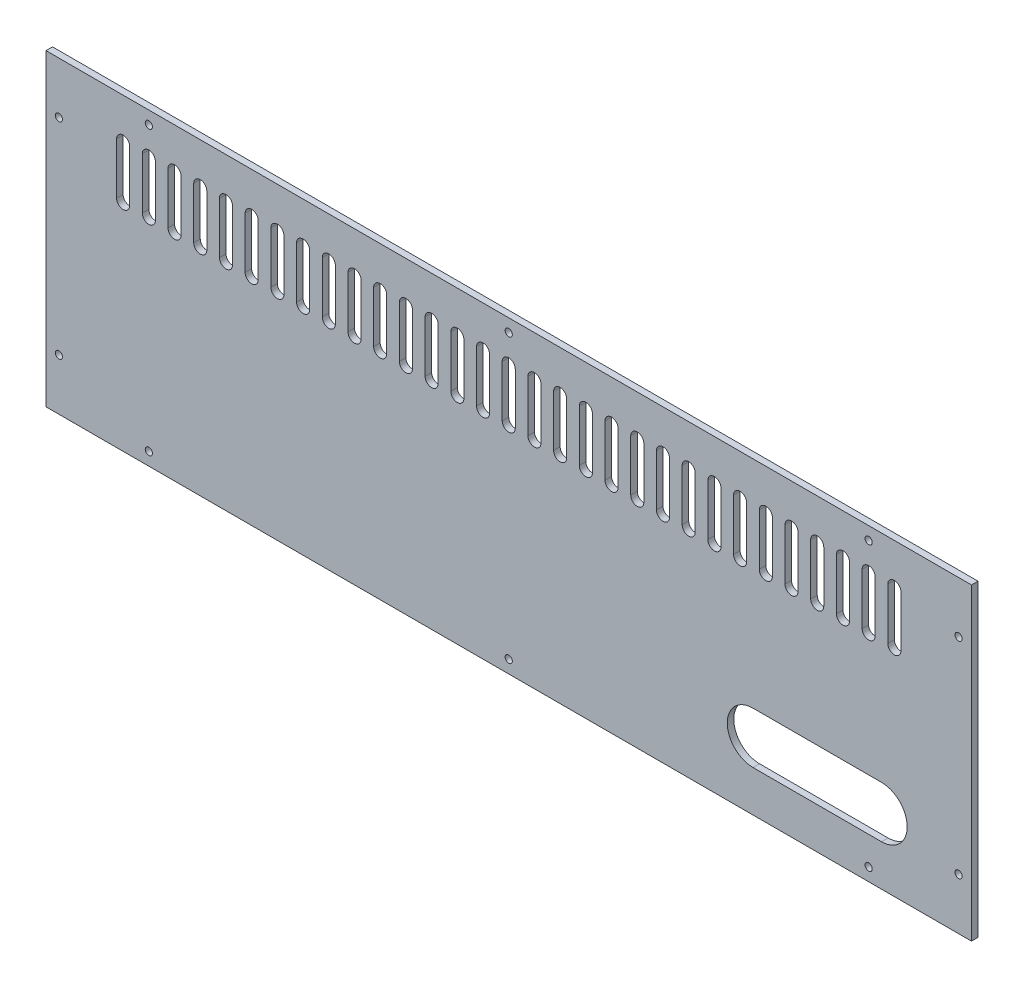
from build123d import *

# Parameters (mm, degrees)
SKETCH2_W           = 900
SKETCH2_H           = 300
BOSS_EXTRUDE1_DEPTH = 6.35
CUT_EXTRUDE1_DEPTH  = 6.35
SKETCH4_R           = 3.5
CUT_EXTRUDE2_DEPTH  = 949.704549636
CUT_EXTRUDE3_DEPTH  = 10


with BuildPart() as part:
    # Sketch2 → Boss-Extrude1 (new body)
    with BuildSketch(Plane.XY):
        with Locations((450, 150)):
            Rectangle(SKETCH2_W, SKETCH2_H)
    extrude(amount=BOSS_EXTRUDE1_DEPTH)

    # Sketch3 → Cut-Extrude1 (cut)
    with BuildSketch(Plane.XY.offset(6.35)):
        with BuildLine():
            Line((443.65, 210), (443.65, 260))
            ThreePointArc((443.65, 260), (450, 266.35), (456.35, 260))
            Line((456.35, 260), (456.35, 210))
            ThreePointArc((456.35, 210), (450, 203.65), (443.65, 210))
        make_face()
        with BuildLine():
            Line((481.35, 210), (481.35, 260))
            ThreePointArc((481.35, 260), (475, 266.35), (468.65, 260))
            Line((468.65, 260), (468.65, 210))
            ThreePointArc((468.65, 210), (475, 203.65), (481.35, 210))
        make_face()
        with BuildLine():
            Line((506.35, 210), (506.35, 260))
            ThreePointArc((506.35, 260), (500, 266.35), (493.65, 260))
            Line((493.65, 260), (493.65, 210))
            ThreePointArc((493.65, 210), (500, 203.65), (506.35, 210))
        make_face()
        with BuildLine():
            Line((531.35, 210), (531.35, 260))
            ThreePointArc((531.35, 260), (525, 266.35), (518.65, 260))
            Line((518.65, 260), (518.65, 210))
            ThreePointArc((518.65, 210), (525, 203.65), (531.35, 210))
        make_face()
        with BuildLine():
            Line((556.35, 210), (556.35, 260))
            ThreePointArc((556.35, 260), (550, 266.35), (543.65, 260))
            Line((543.65, 260), (543.65, 210))
            ThreePointArc((543.65, 210), (550, 203.65), (556.35, 210))
        make_face()
        with BuildLine():
            Line((581.35, 210), (581.35, 260))
            ThreePointArc((581.35, 260), (575, 266.35), (568.65, 260))
            Line((568.65, 260), (568.65, 210))
            ThreePointArc((568.65, 210), (575, 203.65), (581.35, 210))
        make_face()
        with BuildLine():
            Line((606.35, 210), (606.35, 260))
            ThreePointArc((606.35, 260), (600, 266.35), (593.65, 260))
            Line((593.65, 260), (593.65, 210))
            ThreePointArc((593.65, 210), (600, 203.65), (606.35, 210))
        make_face()
        with BuildLine():
            Line((631.35, 210), (631.35, 260))
            ThreePointArc((631.35, 260), (625, 266.35), (618.65, 260))
            Line((618.65, 260), (618.65, 210))
            ThreePointArc((618.65, 210), (625, 203.65), (631.35, 210))
        make_face()
        with BuildLine():
            Line((656.35, 210), (656.35, 260))
            ThreePointArc((656.35, 260), (650, 266.35), (643.65, 260))
            Line((643.65, 260), (643.65, 210))
            ThreePointArc((643.65, 210), (650, 203.65), (656.35, 210))
        make_face()
        with BuildLine():
            Line((681.35, 210), (681.35, 260))
            ThreePointArc((681.35, 260), (675, 266.35), (668.65, 260))
            Line((668.65, 260), (668.65, 210))
            ThreePointArc((668.65, 210), (675, 203.65), (681.35, 210))
        make_face()
        with BuildLine():
            Line((706.35, 210), (706.35, 260))
            ThreePointArc((706.35, 260), (700, 266.35), (693.65, 260))
            Line((693.65, 260), (693.65, 210))
            ThreePointArc((693.65, 210), (700, 203.65), (706.35, 210))
        make_face()
        with BuildLine():
            Line((731.35, 210), (731.35, 260))
            ThreePointArc((731.35, 260), (725, 266.35), (718.65, 260))
            Line((718.65, 260), (718.65, 210))
            ThreePointArc((718.65, 210), (725, 203.65), (731.35, 210))
        make_face()
        with BuildLine():
            Line((756.35, 210), (756.35, 260))
            ThreePointArc((756.35, 260), (750, 266.35), (743.65, 260))
            Line((743.65, 260), (743.65, 210))
            ThreePointArc((743.65, 210), (750, 203.65), (756.35, 210))
        make_face()
        with BuildLine():
            Line((781.35, 210), (781.35, 260))
            ThreePointArc((781.35, 260), (775, 266.35), (768.65, 260))
            Line((768.65, 260), (768.65, 210))
            ThreePointArc((768.65, 210), (775, 203.65), (781.35, 210))
        make_face()
        with BuildLine():
            Line((806.35, 210), (806.35, 260))
            ThreePointArc((806.35, 260), (800, 266.35), (793.65, 260))
            Line((793.65, 260), (793.65, 210))
            ThreePointArc((793.65, 210), (800, 203.65), (806.35, 210))
        make_face()
        with BuildLine():
            Line((831.35, 210), (831.35, 260))
            ThreePointArc((831.35, 260), (825, 266.35), (818.65, 260))
            Line((818.65, 260), (818.65, 210))
            ThreePointArc((818.65, 210), (825, 203.65), (831.35, 210))
        make_face()
        with BuildLine():
            Line((431.35, 210), (431.35, 260))
            ThreePointArc((431.35, 260), (425, 266.35), (418.65, 260))
            Line((418.65, 260), (418.65, 210))
            ThreePointArc((418.65, 210), (425, 203.65), (431.35, 210))
        make_face()
        with BuildLine():
            Line((406.35, 210), (406.35, 260))
            ThreePointArc((406.35, 260), (400, 266.35), (393.65, 260))
            Line((393.65, 260), (393.65, 210))
            ThreePointArc((393.65, 210), (400, 203.65), (406.35, 210))
        make_face()
        with BuildLine():
            Line((381.35, 210), (381.35, 260))
            ThreePointArc((381.35, 260), (375, 266.35), (368.65, 260))
            Line((368.65, 260), (368.65, 210))
            ThreePointArc((368.65, 210), (375, 203.65), (381.35, 210))
        make_face()
        with BuildLine():
            Line((356.35, 210), (356.35, 260))
            ThreePointArc((356.35, 260), (350, 266.35), (343.65, 260))
            Line((343.65, 260), (343.65, 210))
            ThreePointArc((343.65, 210), (350, 203.65), (356.35, 210))
        make_face()
        with BuildLine():
            Line((331.35, 210), (331.35, 260))
            ThreePointArc((331.35, 260), (325, 266.35), (318.65, 260))
            Line((318.65, 260), (318.65, 210))
            ThreePointArc((318.65, 210), (325, 203.65), (331.35, 210))
        make_face()
        with BuildLine():
            Line((306.35, 210), (306.35, 260))
            ThreePointArc((306.35, 260), (300, 266.35), (293.65, 260))
            Line((293.65, 260), (293.65, 210))
            ThreePointArc((293.65, 210), (300, 203.65), (306.35, 210))
        make_face()
        with BuildLine():
            Line((281.35, 210), (281.35, 260))
            ThreePointArc((281.35, 260), (275, 266.35), (268.65, 260))
            Line((268.65, 260), (268.65, 210))
            ThreePointArc((268.65, 210), (275, 203.65), (281.35, 210))
        make_face()
        with BuildLine():
            Line((256.35, 210), (256.35, 260))
            ThreePointArc((256.35, 260), (250, 266.35), (243.65, 260))
            Line((243.65, 260), (243.65, 210))
            ThreePointArc((243.65, 210), (250, 203.65), (256.35, 210))
        make_face()
        with BuildLine():
            Line((231.35, 210), (231.35, 260))
            ThreePointArc((231.35, 260), (225, 266.35), (218.65, 260))
            Line((218.65, 260), (218.65, 210))
            ThreePointArc((218.65, 210), (225, 203.65), (231.35, 210))
        make_face()
        with BuildLine():
            Line((206.35, 210), (206.35, 260))
            ThreePointArc((206.35, 260), (200, 266.35), (193.65, 260))
            Line((193.65, 260), (193.65, 210))
            ThreePointArc((193.65, 210), (200, 203.65), (206.35, 210))
        make_face()
        with BuildLine():
            Line((181.35, 210), (181.35, 260))
            ThreePointArc((181.35, 260), (175, 266.35), (168.65, 260))
            Line((168.65, 260), (168.65, 210))
            ThreePointArc((168.65, 210), (175, 203.65), (181.35, 210))
        make_face()
        with BuildLine():
            Line((156.35, 210), (156.35, 260))
            ThreePointArc((156.35, 260), (150, 266.35), (143.65, 260))
            Line((143.65, 260), (143.65, 210))
            ThreePointArc((143.65, 210), (150, 203.65), (156.35, 210))
        make_face()
        with BuildLine():
            Line((131.35, 210), (131.35, 260))
            ThreePointArc((131.35, 260), (125, 266.35), (118.65, 260))
            Line((118.65, 260), (118.65, 210))
            ThreePointArc((118.65, 210), (125, 203.65), (131.35, 210))
        make_face()
        with BuildLine():
            Line((106.35, 210), (106.35, 260))
            ThreePointArc((106.35, 260), (100, 266.35), (93.65, 260))
            Line((93.65, 260), (93.65, 210))
            ThreePointArc((93.65, 210), (100, 203.65), (106.35, 210))
        make_face()
        with BuildLine():
            Line((81.35, 210), (81.35, 260))
            ThreePointArc((81.35, 260), (75, 266.35), (68.65, 260))
            Line((68.65, 260), (68.65, 210))
            ThreePointArc((68.65, 210), (75, 203.65), (81.35, 210))
        make_face()
    extrude(amount=-CUT_EXTRUDE1_DEPTH, mode=Mode.SUBTRACT)

    # Sketch4 → Cut-Extrude2 (cut, through all)
    with BuildSketch(Plane.XY.offset(6.35)):
        with Locations((12.5, 50)):
            Circle(SKETCH4_R)
        with Locations((12.5, 250)):
            Circle(SKETCH4_R)
        with Locations((450, 287.5)):
            Circle(SKETCH4_R)
        with Locations((800, 287.5)):
            Circle(SKETCH4_R)
        with Locations((100, 287.5)):
            Circle(SKETCH4_R)
        with Locations(Location((887.5, 50, 0), (0, 0, 180))):
            Circle(SKETCH4_R)
        with Locations(Location((887.5, 250, 0), (0, 0, 180))):
            Circle(SKETCH4_R)
        with Locations(Location((800, 12.5, 0), (0, 0, 180))):
            Circle(SKETCH4_R)
        with Locations(Location((450, 12.5, 0), (0, 0, 180))):
            Circle(SKETCH4_R)
        with Locations(Location((100, 12.5, 0), (0, 0, 180))):
            Circle(SKETCH4_R)
    extrude(amount=-CUT_EXTRUDE2_DEPTH, mode=Mode.SUBTRACT)

    # Sketch5 → Cut-Extrude3 (cut)
    with BuildSketch(Plane(origin=(0, 0, 0), x_dir=(-1, 0, 0), z_dir=(0, 0, -1))):
        with BuildLine():
            Line((-812.5, 90), (-687.5, 90))
            ThreePointArc((-687.5, 90), (-662.5, 65), (-687.5, 40))
            Line((-687.5, 40), (-812.5, 40))
            ThreePointArc((-812.5, 40), (-837.5, 65), (-812.5, 90))
        make_face()
    extrude(amount=-CUT_EXTRUDE3_DEPTH, mode=Mode.SUBTRACT)


solid = part.part
